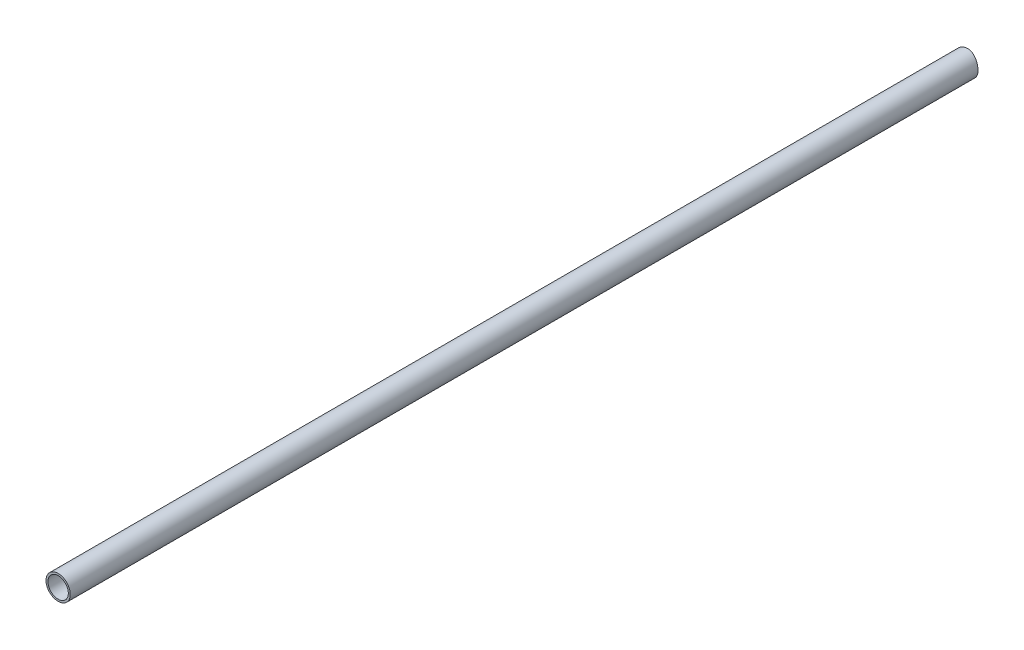
from build123d import *

# Parameters (mm, degrees)
SKETCH1_R               = 13.35
SKETCH1_R_2             = 11.24
BOSS_EXTRUDE1_DEPTH     = 1100
CUT_EXTRUDE1_DEPTH      = 1101.162008524
CUT_EXTRUDE1_DEPTH_BACK = 1101.162008524
SKETCH2_R               = 50
CUT_EXTRUDE2_DEPTH      = 1101.162008627
CUT_EXTRUDE2_DEPTH_BACK = 1101.162008627
SKETCH3_R               = 2231.362480005
SKETCH3_R_2             = 1050


with BuildPart() as part:
    # Sketch1 → Boss-Extrude1 (new body)
    with BuildSketch(Plane.XY):
        Circle(SKETCH1_R)
        Circle(SKETCH1_R_2, mode=Mode.SUBTRACT)
    extrude(amount=BOSS_EXTRUDE1_DEPTH)

    # Sketch2 → Cut-Extrude1 (cut, two sides: drawn at the far end of the back side and taken through both)
    with BuildSketch(Plane(origin=(0, 0, 0), x_dir=(0, 0, -1), z_dir=(1, 0, 0)).offset(-CUT_EXTRUDE1_DEPTH_BACK)):
        Circle(SKETCH2_R)
    extrude(amount=CUT_EXTRUDE1_DEPTH + CUT_EXTRUDE1_DEPTH_BACK, mode=Mode.SUBTRACT)

    # Sketch3 → Cut-Extrude2 (cut, two sides: drawn at the far end of the back side and taken through both)
    with BuildSketch(Plane(origin=(0, 0, 0), x_dir=(0, 0, -1), z_dir=(1, 0, 0)).offset(-CUT_EXTRUDE2_DEPTH_BACK)):
        Circle(SKETCH3_R)
        Circle(SKETCH3_R_2, mode=Mode.SUBTRACT)
    extrude(amount=CUT_EXTRUDE2_DEPTH + CUT_EXTRUDE2_DEPTH_BACK, mode=Mode.SUBTRACT)


solid = part.part
